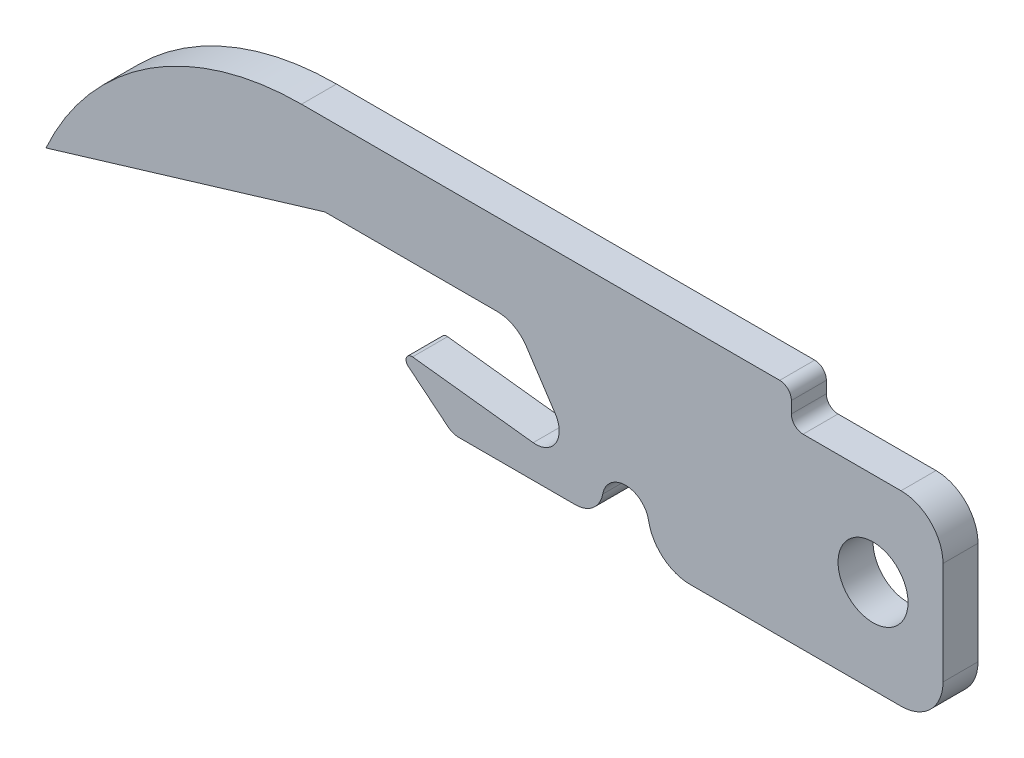
from build123d import *

# Parameters (mm, degrees)
SKETCH1_R           = 1.5
BOSS_EXTRUDE1_DEPTH = 0.75
FILLET1_R           = 1.8


with BuildPart() as part:
    # Sketch1 → Boss-Extrude1 (new, symmetric)
    with BuildSketch(Plane.XY):
        with BuildLine():
            Line((10.953994705, 9.5), (31.453994705, 9.5))
            ThreePointArc((31.453994705, 9.5), (31.807548096, 9.353553391), (31.953994705, 9))
            Line((31.953994705, 9), (31.953994705, 8.5))
            ThreePointArc((31.953994705, 8.5), (32.100441315, 8.146446609), (32.453994705, 8))
            Line((32.453994705, 8), (38.453994705, 8))
            Line((38.453994705, 8), (38.453994705, 0))
            Line((38.453994705, 0), (27.61132699, 0))
            ThreePointArc((27.61132699, 0), (26.453994705, 0.418752726), (25.83256534, 1.481107378))
            ThreePointArc((25.83256534, 1.481107378), (24.849102012, 2.3), (23.865638684, 1.481107378))
            ThreePointArc((23.865638684, 1.481107378), (23.453994705, 0.777387983), (22.687360725, 0.5))
            Line((22.687360725, 0.5), (17.705397605, 0.5))
            ThreePointArc((17.705397605, 0.5), (17.453994705, 0.543390786), (17.231681323, 0.668542449))
            Line((17.231681323, 0.668542449), (15.526396166, 2.057846521))
            ThreePointArc((15.526396166, 2.057846521), (15.453994705, 2.348921744), (15.713112665, 2.5))
            Line((15.713112665, 2.5), (20.884755714, 1.9))
            ThreePointArc((20.884755714, 1.9), (21.851554423, 2.369070966), (21.83503998, 3.44352645))
            Line((21.83503998, 3.44352645), (20.595191848, 5.325283904))
            ThreePointArc((20.595191848, 5.325283904), (20.053994705, 5.820591886), (19.342631878, 6))
            Line((19.342631878, 6), (11.953994705, 6))
            Line((11.953994705, 6), (0, 2.4))
            ThreePointArc((0, 2.4), (4.427127156, 7.5697567), (10.953994705, 9.5))
        make_face()
        with Locations((35.453994705, 4)):
            Circle(SKETCH1_R, mode=Mode.SUBTRACT)
    extrude(amount=BOSS_EXTRUDE1_DEPTH, both=True)

    # Fillet1
    fillet1_edges = [part.edges().sort_by_distance(p)[0] for p in [
        (38.453994705, 8, 0),
        (38.453994705, 0, 0),
    ]]
    fillet(fillet1_edges, radius=FILLET1_R)


solid = part.part
